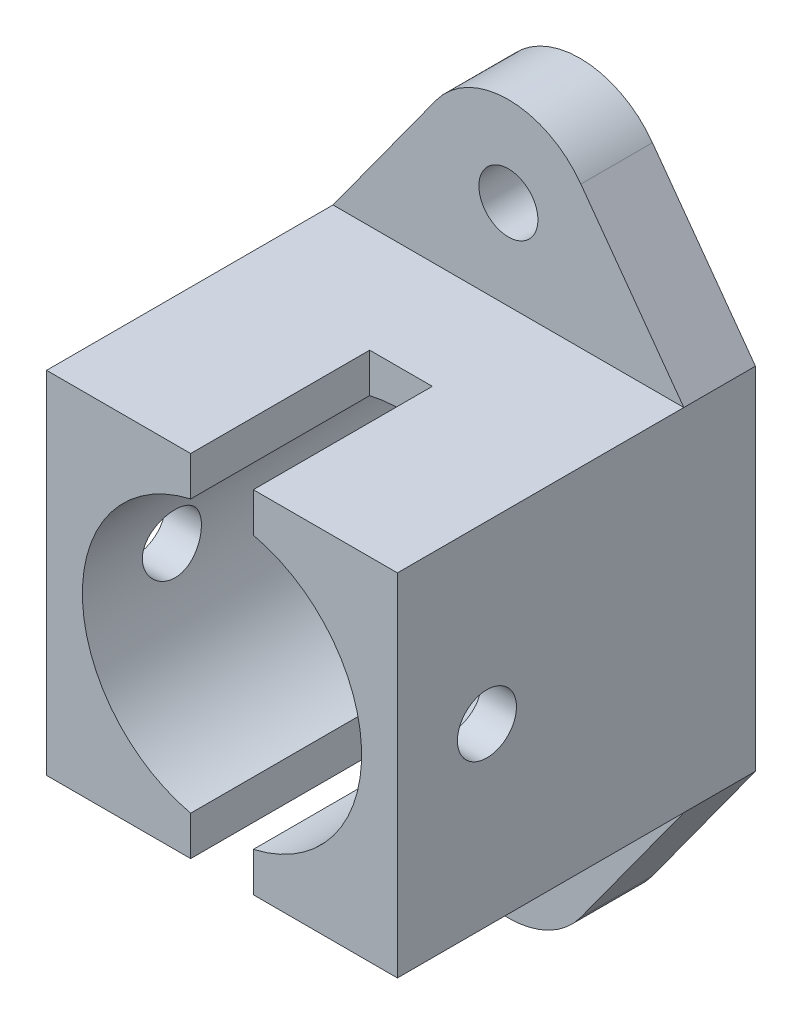
from build123d import *

# Parameters (mm, degrees)
SKETCH_1_W          = 19.6
SKETCH_1_H          = 19.6
SKETCH_1_R          = 7.8
EXTRUDE_1_DEPTH     = 20
SKETCH_2_R          = 1.65
EXTRUDE_2_DEPTH     = 4
SKETCH_3_R          = 1.65
CUT_EXTRUDE_1_DEPTH = 35.295772334
SKETCH_4_W          = 3.5
SKETCH_4_H          = 19.6
CUT_EXTRUDE_2_DEPTH = 10


with BuildPart() as part:
    # 草图1 → 凸台-拉伸1 (new body)
    with BuildSketch(Plane.XY):
        Rectangle(SKETCH_1_W, SKETCH_1_H)
        Circle(SKETCH_1_R, mode=Mode.SUBTRACT)
    extrude(amount=EXTRUDE_1_DEPTH)

    # 草图2 → 凸台-拉伸2 (add)
    # profile 1 of 2: a face of its own
    with BuildSketch(Plane(origin=(0, 0, 0), x_dir=(-1, 0, 0), z_dir=(0, 0, -1))):
        with BuildLine():
            Line((-9.8, 9.8), (-4.048248513, 17.734567085))
            ThreePointArc((-4.048248513, 17.734567085), (0, 19.8), (4.048248513, 17.734567085))
            Line((4.048248513, 17.734567085), (9.8, 9.8))
            Line((9.8, 9.8), (-9.8, 9.8))
        make_face()
        with Locations((0, 14.8)):
            Circle(SKETCH_2_R, mode=Mode.SUBTRACT)
    # profile 2 of 2: a face of its own
    with BuildSketch(Plane(origin=(0, 0, 0), x_dir=(-1, 0, 0), z_dir=(0, 0, -1))):
        with BuildLine():
            Line((-9.8, -9.8), (9.8, -9.8))
            Line((9.8, -9.8), (4.048248513, -17.734567085))
            ThreePointArc((4.048248513, -17.734567085), (0, -19.8), (-4.048248513, -17.734567085))
            Line((-4.048248513, -17.734567085), (-9.8, -9.8))
        make_face()
        with Locations(Location((0, -14.8, 0), (0, 0, 180))):
            Circle(SKETCH_2_R, mode=Mode.SUBTRACT)
    extrude(amount=-EXTRUDE_2_DEPTH)

    # 草图3 → 切除-拉伸1 (cut, through all)
    with BuildSketch(Plane(origin=(9.8, 0, 0), x_dir=(0, 0, -1), z_dir=(1, 0, 0))):
        with Locations((-15, 0)):
            Circle(SKETCH_3_R)
    extrude(amount=-CUT_EXTRUDE_1_DEPTH, mode=Mode.SUBTRACT)

    # 草图4 → 切除-拉伸2 (cut)
    with BuildSketch(Plane.XY.offset(20)):
        Rectangle(SKETCH_4_W, SKETCH_4_H)
    extrude(amount=-CUT_EXTRUDE_2_DEPTH, mode=Mode.SUBTRACT)


solid = part.part
